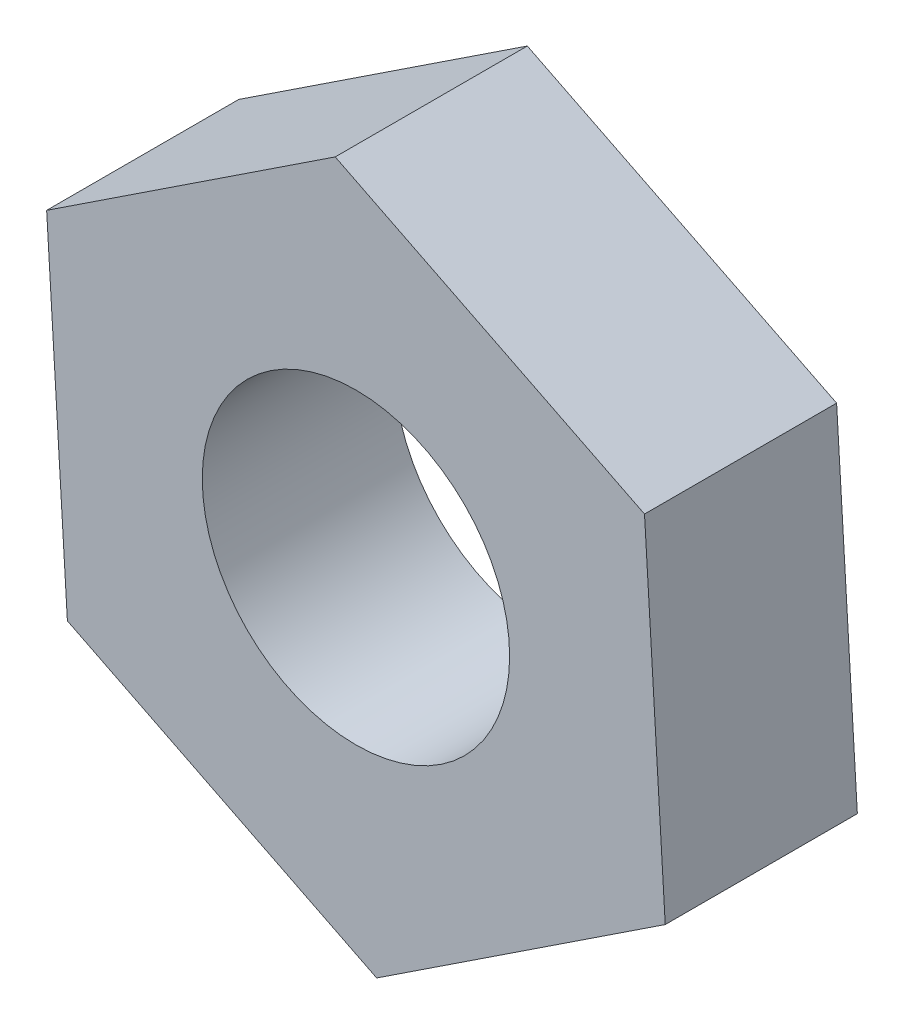
from build123d import *

# Parameters (mm, degrees)
SKETCH1_R           = 4
BOSS_EXTRUDE1_DEPTH = 5


with BuildPart() as part:
    # Sketch1 → Boss-Extrude1 (new body)
    with BuildSketch(Plane.XY):
        Polygon((-0.539663236, 8.98380563), (-8.050035516, 4.024540743), (-7.51037228, -4.959264886), (0.539663236, -8.98380563), (8.050035516, -4.024540743), (7.51037228, 4.959264886), align=None)
        Circle(SKETCH1_R, mode=Mode.SUBTRACT)
    extrude(amount=BOSS_EXTRUDE1_DEPTH)


solid = part.part
